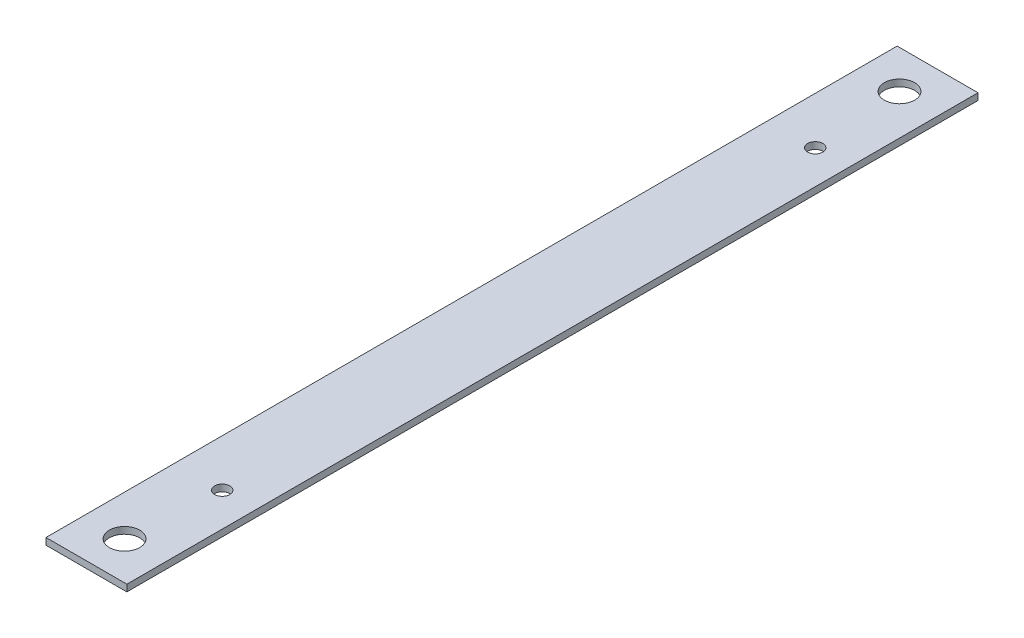
from build123d import *

# Parameters (mm, degrees)
SKETCH1_W           = 38.1
SKETCH1_H           = 3.175
BOSS_EXTRUDE1_DEPTH = 401.0152
SKETCH2_R           = 7.14375
SKETCH2_R_2         = 3.556
CUT_EXTRUDE1_DEPTH  = 403.833565205


with BuildPart() as part:
    # Sketch1 → Boss-Extrude1 (new body)
    with BuildSketch(Plane.XY):
        with Locations((19.05, 1.5875)):
            Rectangle(SKETCH1_W, SKETCH1_H)
    extrude(amount=BOSS_EXTRUDE1_DEPTH)

    # Sketch2 → Cut-Extrude1 (cut, through all)
    with BuildSketch(Plane(origin=(0, 3.175, 0), x_dir=(1, 0, 0), z_dir=(0, 1, 0))):
        with Locations(Location((19.05, -383.0701, 0), (0, 0, 270))):
            Circle(SKETCH2_R)
        with Locations(Location((19.05, -17.9451, 0), (0, 0, 270))):
            Circle(SKETCH2_R)
        with Locations(Location((22.225, -60.8076, 0), (0, 0, 270))):
            Circle(SKETCH2_R_2)
        with Locations(Location((22.225, -340.2076, 0), (0, 0, 90))):
            Circle(SKETCH2_R_2)
    extrude(amount=-CUT_EXTRUDE1_DEPTH, mode=Mode.SUBTRACT)


solid = part.part
